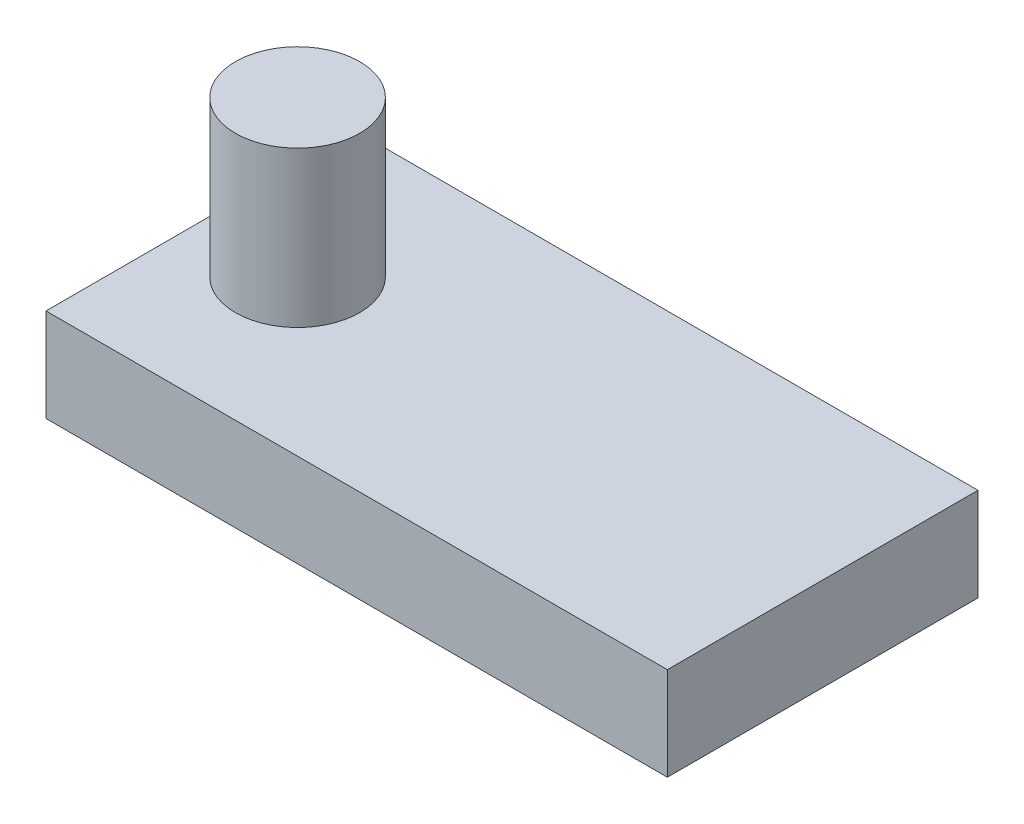
from build123d import *

# Parameters (mm, degrees)
SKETCH2_W           = 50.8
SKETCH2_H           = 25.4
BOSS_EXTRUDE1_DEPTH = 7.62
SKETCH3_R           = 5.08
BOSS_EXTRUDE2_DEPTH = 12.7


with BuildPart() as part:
    # Sketch2 → Boss-Extrude1 (new body)
    with BuildSketch(Plane(origin=(0, 0, 0), x_dir=(1, 0, 0), z_dir=(0, 1, 0))):
        Rectangle(SKETCH2_W, SKETCH2_H)
    extrude(amount=BOSS_EXTRUDE1_DEPTH)

    # Sketch3 → Boss-Extrude2 (add)
    with BuildSketch(Plane(origin=(0, 7.62, 0), x_dir=(1, 0, 0), z_dir=(0, 1, 0))):
        with Locations(Location((-17.532197906, 0, 0), (0, 0, 270))):
            Circle(SKETCH3_R)
    extrude(amount=BOSS_EXTRUDE2_DEPTH)


solid = part.part
